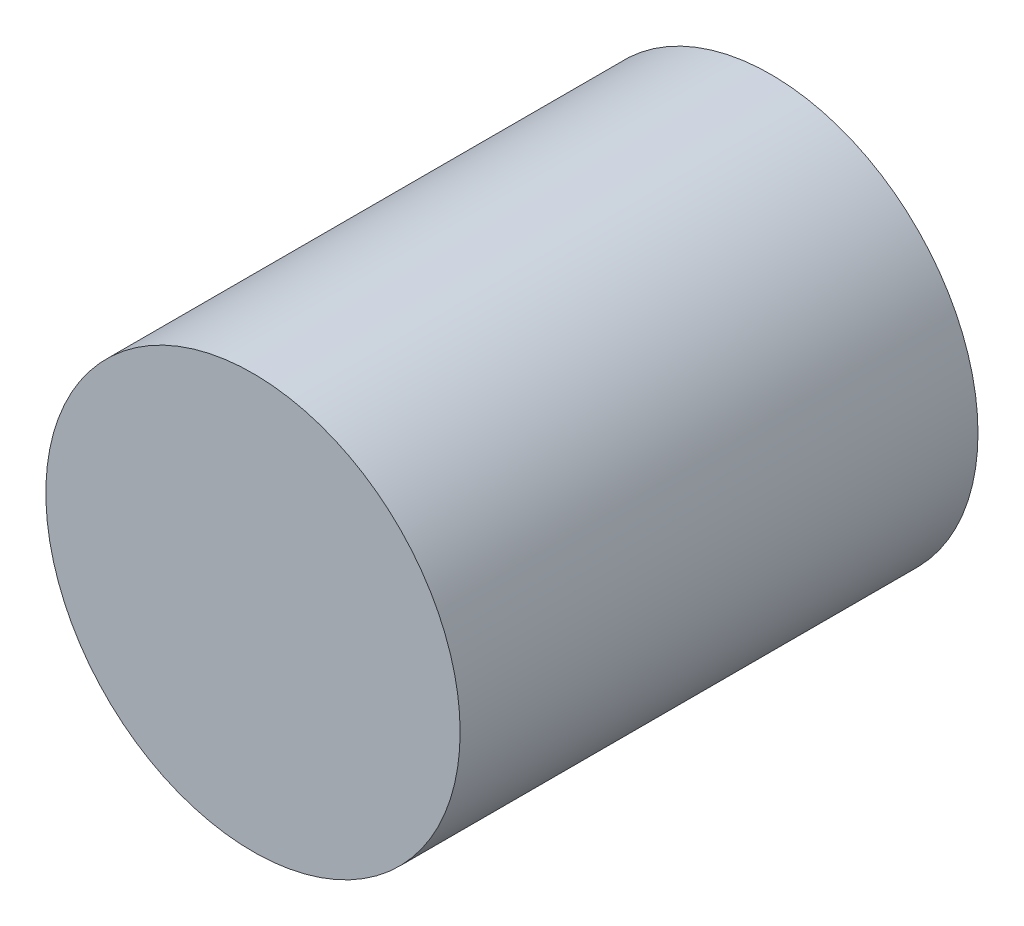
from build123d import *

# Parameters (mm, degrees)
SKETCH_1_R      = 20
EXTRUDE_1_DEPTH = 50


with BuildPart() as part:
    # 草图1 → 凸台-拉伸1 (new body)
    with BuildSketch(Plane.XY):
        Circle(SKETCH_1_R)
    extrude(amount=-EXTRUDE_1_DEPTH)


solid = part.part
